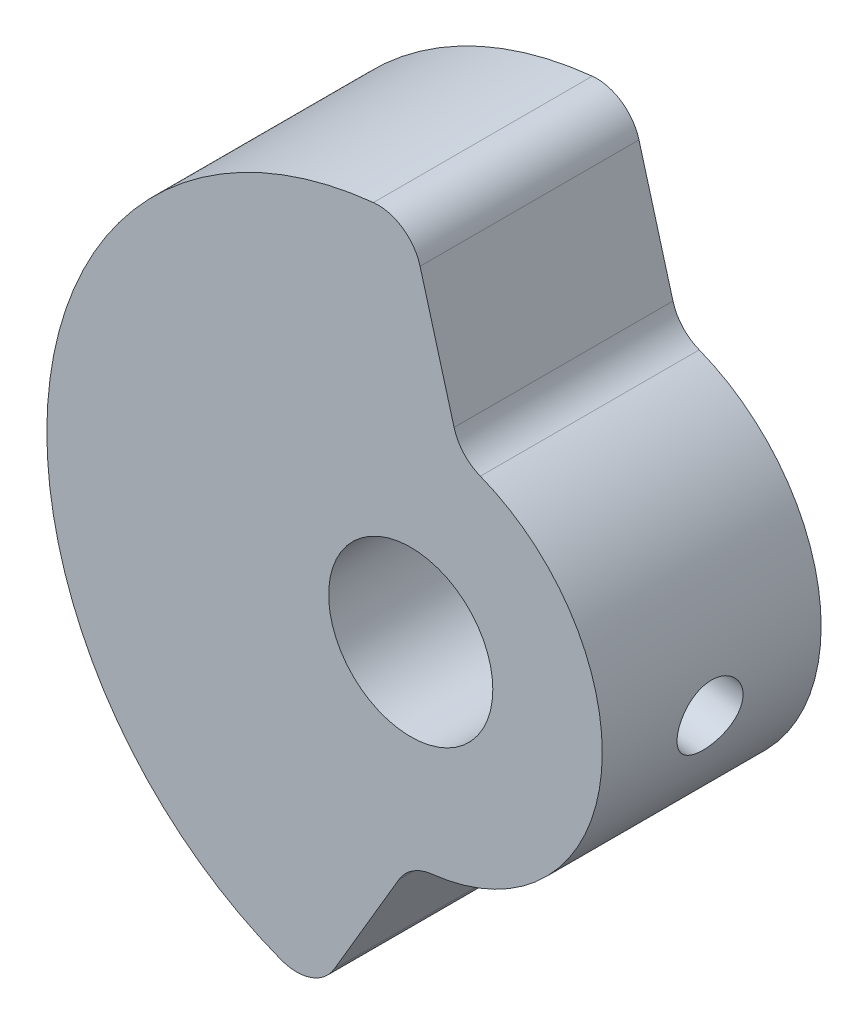
from build123d import *

# Parameters (mm, degrees)
SKETCH1_R                   = 4.7625
BOSS_EXTRUDE1_DEPTH         = 12.7
FILLET1_R                   = 2.54
F_10_24_TAPPED_HOLE1_REACH  = 41.709
F_10_24_TAPPED_HOLE1_BORE_R = 1.89865


with BuildPart() as part:
    # Sketch1 → Boss-Extrude1 (new body)
    with BuildSketch(Plane.XY):
        with BuildLine():
            Line((-5.46431709, -20.393109008), (0, -11.1125))
            ThreePointArc((0, -11.1125), (11.017431022, -1.450472311), (2.876126639, 10.733850745))
            Line((2.876126639, 10.733850745), (0, 21.1125))
            ThreePointArc((0, 21.1125), (-20.931879636, 2.755734233), (-5.46431709, -20.393109008))
        make_face()
        Circle(SKETCH1_R, mode=Mode.SUBTRACT)
    extrude(amount=BOSS_EXTRUDE1_DEPTH)

    # Fillet1
    fillet1_edges = [part.edges().sort_by_distance(p)[0] for p in [
        (2.876126639, 10.733850745, 6.35),
        (0, -11.1125, 6.35),
        (-5.46431709, -20.393109008, 6.35),
        (0, 21.1125, 6.35),
    ]]
    fillet(fillet1_edges, radius=FILLET1_R)

    # #10-24 Tapped Hole1 bore (on position points) → #10-24 Tapped Hole1 (cut, up to next)
    with BuildSketch(Plane(origin=(11.019222387, -1.436799975, 6.35), x_dir=(0.129295835761, 0.99160606435, 0), z_dir=(0.99160606435, -0.129295835761, 0)), mode=Mode.PRIVATE) as f_10_24_tapped_hole1_sk1:
        with Locations((1e-09, 0)):
            Circle(F_10_24_TAPPED_HOLE1_BORE_R)
    f_10_24_tapped_hole1_tool1 = extrude(f_10_24_tapped_hole1_sk1.sketch, amount=-F_10_24_TAPPED_HOLE1_REACH, mode=Mode.PRIVATE) & part.part
    add(f_10_24_tapped_hole1_tool1.solids().sort_by_distance((11.019222, -1.4368, 6.35))[0], mode=Mode.SUBTRACT)


solid = part.part
